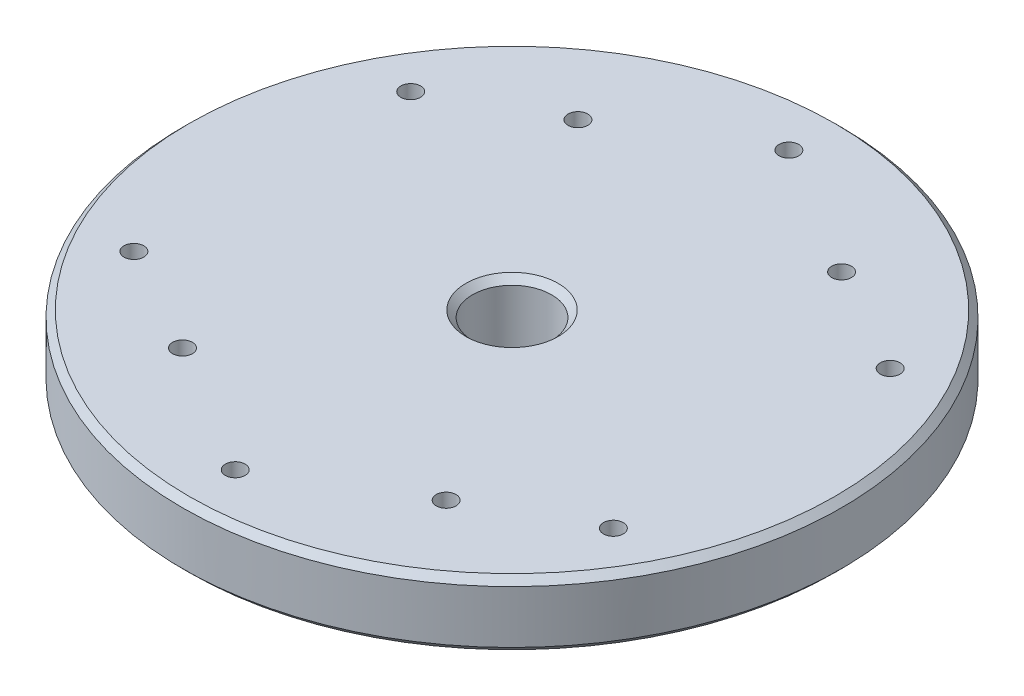
from build123d import *

# Parameters (mm, degrees)
BOSS_EXTRUDE2_REACH = 44.382
SKETCH3_W           = 1
SKETCH3_H           = 6.5
CIRPATTERN1_COUNT   = 6
SKETCH5_R           = 0.75
CUT_EXTRUDE1_DEPTH  = 39.213217609
CIRPATTERN2_COUNT   = 6
SKETCH6_R           = 0.75
CUT_EXTRUDE2_DEPTH  = 39.213217609
CHAMFER1_SIZE       = 0.5


with BuildPart() as part:
    # Sketch1 → Revolve1 (revolve)
    with BuildSketch(Plane.XY, mode=Mode.PRIVATE) as revolve1_sk:
        Polygon((1.6, 0), (2, 0), (6.551348998, 6.5), (6.551348998, 9.5), (25, 9.5), (25, 14.5), (3, 14.5), (3, 5.2), (1.6, 3.8), align=None)
    revolve(revolve1_sk.sketch.rotate(Axis((0, 0, 0), (0, 1, 0)), 90), axis=Axis((0, 0, 0), (0, 1, 0)))

    # Sketch3 → Boss-Extrude2 (add, up to next)
    with BuildSketch(Plane.XY.offset(6), mode=Mode.PRIVATE) as boss_extrude2_sk1:
        with Locations((0, 3.25)):
            Rectangle(SKETCH3_W, SKETCH3_H)
    boss_extrude2_tool1 = extrude(boss_extrude2_sk1.sketch, amount=-BOSS_EXTRUDE2_REACH, mode=Mode.PRIVATE) - part.part
    boss_extrude2 = boss_extrude2_tool1.solids().sort_by_distance((0, 3.25, 6))[0]
    add(boss_extrude2)

    # CirPattern1: Boss-Extrude2 ×6 about axis
    cirpattern1_axis = Axis((0, 0, 0), (0, 1, 0))
    for i in range(1, CIRPATTERN1_COUNT):
        add(boss_extrude2.rotate(cirpattern1_axis, i * 360 / CIRPATTERN1_COUNT))

    # Sketch5 → Cut-Extrude1 (cut, through all)
    with BuildSketch(Plane(origin=(0, 14.5, 0), x_dir=(1, 0, 0), z_dir=(0, 1, 0))):
        with Locations(Location((0, 21, 0), (0, 0, 270))):
            Circle(SKETCH5_R)
    cut_extrude1 = extrude(amount=-CUT_EXTRUDE1_DEPTH, mode=Mode.SUBTRACT)

    # CirPattern2: Cut-Extrude1 ×6 about axis
    cirpattern2_axis = Axis((0, 0, 0), (0, 1, 0))
    for i in range(1, CIRPATTERN2_COUNT):
        add(cut_extrude1.rotate(cirpattern2_axis, i * 360 / CIRPATTERN2_COUNT), mode=Mode.SUBTRACT)

    # Sketch6 → Cut-Extrude2 (cut, through all)
    with BuildSketch(Plane(origin=(0, 14.5, 0), x_dir=(1, 0, 0), z_dir=(0, 1, 0))):
        with Locations(Location((-10, 15, 0), (0, 0, 270))):
            Circle(SKETCH6_R)
        with Locations(Location((10, 15, 0), (0, 0, 270))):
            Circle(SKETCH6_R)
        with Locations(Location((-10, -15, 0), (0, 0, 270))):
            Circle(SKETCH6_R)
        with Locations(Location((10, -15, 0), (0, 0, 270))):
            Circle(SKETCH6_R)
    extrude(amount=-CUT_EXTRUDE2_DEPTH, mode=Mode.SUBTRACT)

    # Chamfer1
    chamfer1_edges = [part.edges().sort_by_distance(p)[0] for p in [
        (0, 14.5, 3),
        (0, 14.5, 25),
        (0, 9.5, 25),
    ]]
    chamfer(chamfer1_edges, length=CHAMFER1_SIZE)


solid = part.part
